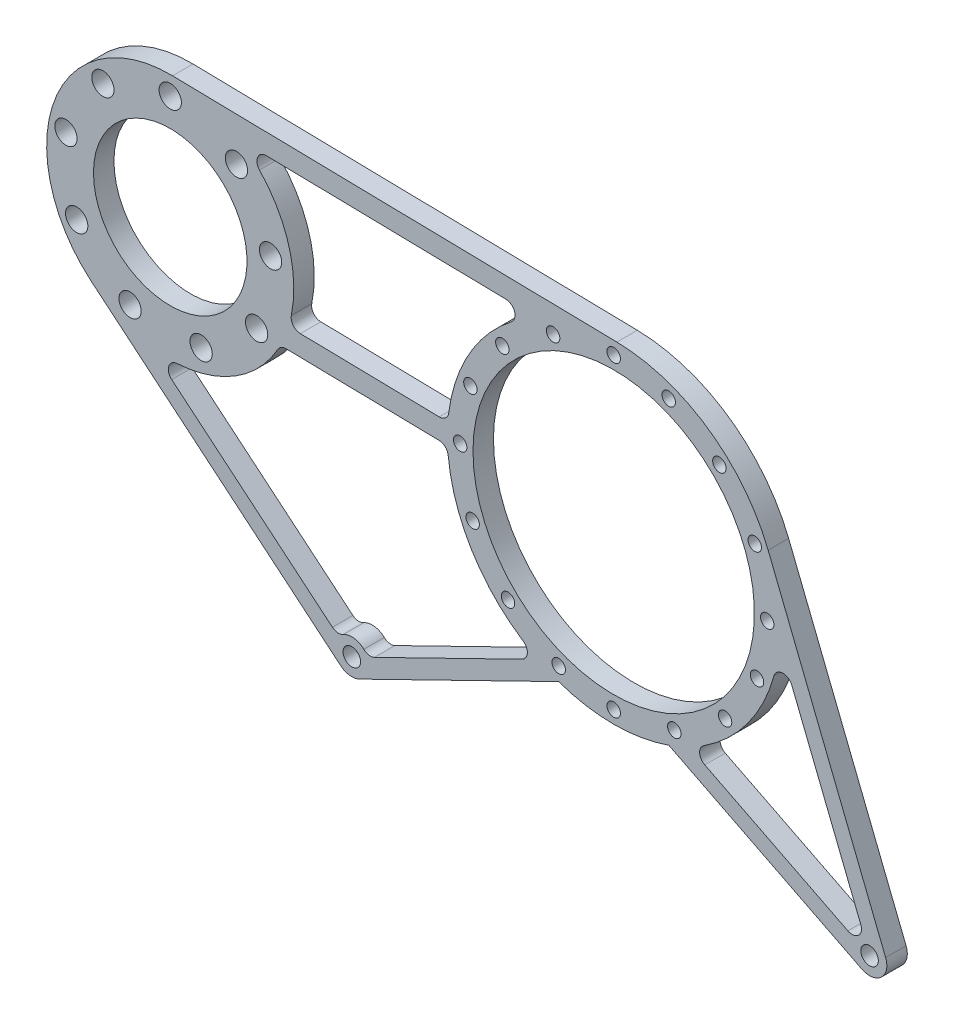
from build123d import *

# Parameters (mm, degrees)
SKETCH2_R               = 28.575
SKETCH2_R_2             = 3.2639
SKETCH2_R_3             = 52.3875
BOSS_EXTRUDE1_DEPTH     = 7.62
CUT_EXTRUDE1_DEPTH      = 369.60849746
CUT_EXTRUDE1_DEPTH_BACK = 369.60849746
SKETCH3_R               = 4.15
SKETCH3_R_2             = 2.5
CUT_EXTRUDE2_DEPTH      = 369.60849746
CUT_EXTRUDE2_DEPTH_BACK = 369.60849746


with BuildPart() as part:
    # Sketch2 → Boss-Extrude1 (new body)
    with BuildSketch(Plane.XY):
        with BuildLine():
            Line((-308.875210247, 91.684111495), (-215.925303767, 14.10662012))
            ThreePointArc((-215.925303767, 14.10662012), (-212.572234871, 12.65763879), (-208.970475069, 13.265869211))
            Line((-208.970475069, 13.265869211), (-134.814952137, 49.535152614))
            ThreePointArc((-134.814952137, 49.535152614), (-114.3, 46.0375), (-93.785047863, 49.535152614))
            Line((-93.785047863, 49.535152614), (-21.949808906, 13.301039962))
            ThreePointArc((-21.949808906, 13.301039962), (-14.699565425, 14.303090245), (-13.070560605, 21.438668609))
            Line((-13.070560605, 21.438668609), (-56.805390428, 130.917967399))
            ThreePointArc((-56.805390428, 130.917967399), (-79.093597182, 158.878055695), (-113.124724735, 169.851343962))
            Line((-113.124724735, 169.851343962), (-278.526789224, 172.991711242))
            ThreePointArc((-278.526789224, 172.991711242), (-322.495823899, 143.085706774), (-308.875210247, 91.684111495))
        make_face()
        with Locations(Location((-279.4, 127, 0), (0, 0, 180))):
            Circle(SKETCH2_R, mode=Mode.SUBTRACT)
        with Locations(Location((-19.05, 19.05, 0), (0, 0, 180))):
            Circle(SKETCH2_R_2, mode=Mode.SUBTRACT)
        with Locations(Location((-211.799479175, 19.05, 0), (0, 0, 180))):
            Circle(SKETCH2_R_2, mode=Mode.SUBTRACT)
        with Locations(Location((-114.3, 107.95, 0), (0, 0, 180))):
            Circle(SKETCH2_R_3, mode=Mode.SUBTRACT)
    extrude(amount=BOSS_EXTRUDE1_DEPTH)

    # Sketch3 → Cut-Extrude1 (cut, two sides: drawn at the far end of the back side and taken through both)
    with BuildSketch(Plane.XY.offset(7.62).offset(-CUT_EXTRUDE1_DEPTH_BACK)):
        with Locations((-279.4, 166.00043)):
            Circle(SKETCH3_R)
        with Locations((-254.746524018, 156.380868571)):
            Circle(SKETCH3_R)
        with Locations((-242.044200635, 133.164908097)):
            Circle(SKETCH3_R)
        with Locations((-247.236588134, 107.215554499)):
            Circle(SKETCH3_R)
        with Locations((-267.894110695, 90.674798722)):
            Circle(SKETCH3_R)
        with Locations((-294.35088393, 91.282244222)):
            Circle(SKETCH3_R)
        with Locations((-314.227489609, 108.753660501)):
            Circle(SKETCH3_R)
        with Locations((-318.223443029, 134.913977707)):
            Circle(SKETCH3_R)
        with Locations((-304.468993176, 157.522492681)):
            Circle(SKETCH3_R)
        with Locations((-114.3, 165.1)):
            Circle(SKETCH3_R_2)
        with Locations((-93.819271683, 161.304121374)):
            Circle(SKETCH3_R_2)
        with Locations((-74.960535999, 149.405145303)):
            Circle(SKETCH3_R_2)
        with Locations((-61.79108234, 130.509611392)):
            Circle(SKETCH3_R_2)
        with Locations((-57.15, 107.95)):
            Circle(SKETCH3_R_2)
        with Locations((-60.945878626, 87.469271683)):
            Circle(SKETCH3_R_2)
        with Locations((-72.844854697, 68.610535999)):
            Circle(SKETCH3_R_2)
        with Locations((-91.740388608, 55.44108234)):
            Circle(SKETCH3_R_2)
        with Locations((-114.3, 50.8)):
            Circle(SKETCH3_R_2)
        with Locations((-134.780728317, 54.595878626)):
            Circle(SKETCH3_R_2)
        with Locations((-153.639464001, 66.494854697)):
            Circle(SKETCH3_R_2)
        with Locations((-166.80891766, 85.390388608)):
            Circle(SKETCH3_R_2)
        with Locations((-171.45, 107.95)):
            Circle(SKETCH3_R_2)
        with Locations((-167.654121374, 128.430728317)):
            Circle(SKETCH3_R_2)
        with Locations((-155.755145303, 147.289464001)):
            Circle(SKETCH3_R_2)
        with Locations((-136.859611392, 160.45891766)):
            Circle(SKETCH3_R_2)
    extrude(amount=CUT_EXTRUDE1_DEPTH + CUT_EXTRUDE1_DEPTH_BACK, mode=Mode.SUBTRACT)

    # Sketch4 → Cut-Extrude2 (cut, two sides: drawn at the far end of the back side and taken through both)
    with BuildSketch(Plane.XY.offset(7.62).offset(-CUT_EXTRUDE2_DEPTH_BACK)):
        with BuildLine():
            Line((-278.860225121, 74.904185455), (-219.01939843, 24.960066172))
            ThreePointArc((-219.01939843, 24.960066172), (-217.078020776, 24.161494872), (-215.029526872, 24.620118947))
            ThreePointArc((-215.029526872, 24.620118947), (-211.026723478, 25.44236121), (-207.335161059, 23.689967346))
            ThreePointArc((-207.335161059, 23.689967346), (-205.454963796, 22.756414152), (-203.379217054, 23.069365873))
            Line((-203.379217054, 23.069365873), (-148.393096208, 49.962941986))
            ThreePointArc((-148.393096208, 49.962941986), (-146.441473652, 52.888826728), (-148.025123052, 56.029158988))
            ThreePointArc((-148.025123052, 56.029158988), (-167.202514386, 75.786641533), (-175.91672865, 101.90546472))
            ThreePointArc((-175.91672865, 101.90546472), (-177.022168822, 104.129423143), (-179.326246533, 105.05636162))
            Line((-179.326246533, 105.05636162), (-236.248291515, 106.1370986))
            ThreePointArc((-236.248291515, 106.1370986), (-238.04588498, 105.678406249), (-239.35496486, 104.363852787))
            ThreePointArc((-239.35496486, 104.363852787), (-255.112552192, 87.934415671), (-276.81836003, 81.072501319))
            ThreePointArc((-276.81836003, 81.072501319), (-279.937917376, 78.683040095), (-278.860225121, 74.904185455))
        make_face()
        with BuildLine():
            Line((-48.019318761, 91.807143198), (-22.303873454, 27.434904147))
            ThreePointArc((-22.303873454, 27.434904147), (-23.187455951, 23.564521405), (-27.120033775, 23.021003007))
            Line((-27.120033775, 23.021003007), (-80.387932313, 49.889641079))
            ThreePointArc((-80.387932313, 49.889641079), (-82.302626367, 52.822384958), (-80.709884678, 55.941714036))
            ThreePointArc((-80.709884678, 55.941714036), (-64.405072396, 71.294115674), (-54.62867895, 91.442695545))
            ThreePointArc((-54.62867895, 91.442695545), (-51.454892751, 93.998716793), (-48.019318761, 91.807143198))
        make_face()
        with BuildLine():
            Line((-243.572637688, 164.706689191), (-154.458722757, 163.014748867))
            ThreePointArc((-154.458722757, 163.014748867), (-151.211699304, 160.627169805), (-152.377082357, 156.768986628))
            ThreePointArc((-152.377082357, 156.768986628), (-168.115145357, 138.561889625), (-175.721811685, 115.729376938))
            ThreePointArc((-175.721811685, 115.729376938), (-176.902393858, 113.526279988), (-179.252929411, 112.6763429))
            Line((-179.252929411, 112.6763429), (-230.963872105, 113.658140516))
            ThreePointArc((-230.963872105, 113.658140516), (-233.622605418, 114.965574686), (-234.320208682, 117.845087947))
            ThreePointArc((-234.320208682, 117.845087947), (-235.210231249, 139.777493405), (-246.162459408, 158.800407158))
            ThreePointArc((-246.162459408, 158.800407158), (-246.837455621, 162.61732476), (-243.572637688, 164.706689191))
        make_face()
    extrude(amount=CUT_EXTRUDE2_DEPTH + CUT_EXTRUDE2_DEPTH_BACK, mode=Mode.SUBTRACT)


solid = part.part
